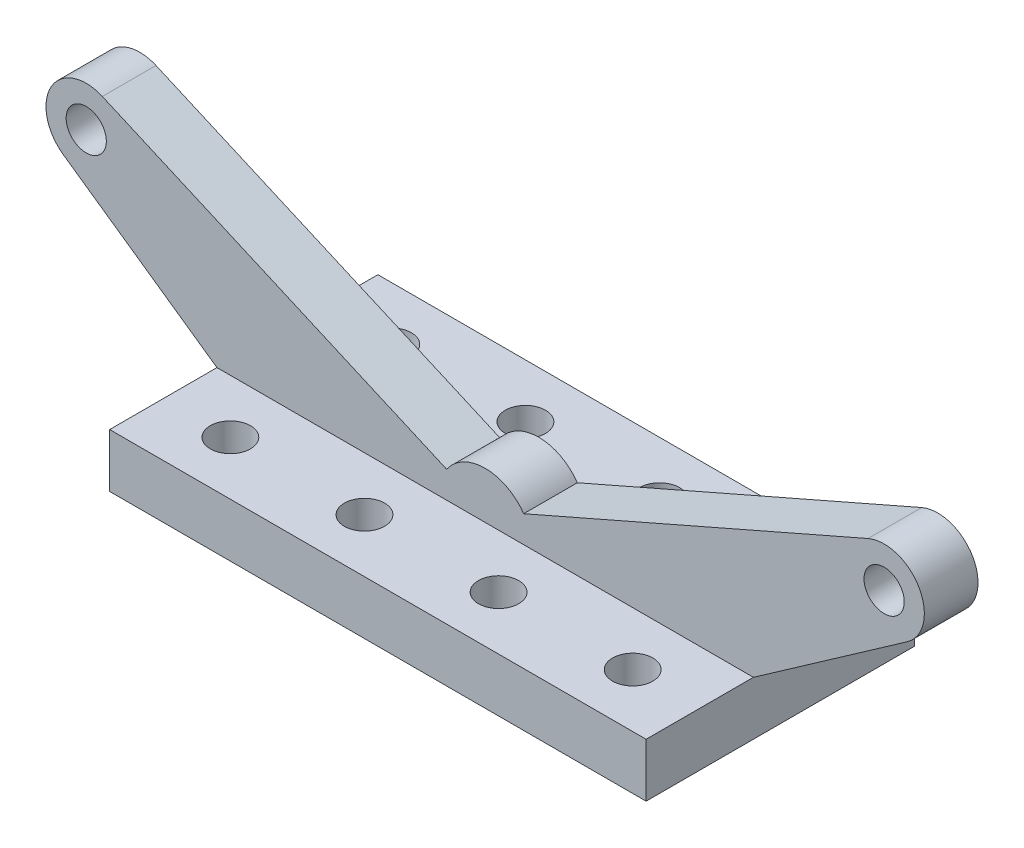
from build123d import *

# Parameters (mm, degrees)
SKETCH1_W           = 200
SKETCH1_H           = 100
SKETCH1_R           = 7.5
BOSS_EXTRUDE1_DEPTH = 20
SKETCH2_R           = 7.5
BOSS_EXTRUDE2_DEPTH = 10


with BuildPart() as part:
    # Sketch1 → Boss-Extrude1 (new body)
    with BuildSketch(Plane(origin=(0, 0, 0), x_dir=(1, 0, 0), z_dir=(0, 1, 0))):
        Rectangle(SKETCH1_W, SKETCH1_H)
        with Locations(Location((-75, 30, 0), (0, 0, 270))):
            Circle(SKETCH1_R, mode=Mode.SUBTRACT)
        with Locations(Location((-75, -30, 0), (0, 0, 270))):
            Circle(SKETCH1_R, mode=Mode.SUBTRACT)
        with Locations(Location((-25, 30, 0), (0, 0, 270))):
            Circle(SKETCH1_R, mode=Mode.SUBTRACT)
        with Locations(Location((-25, -30, 0), (0, 0, 270))):
            Circle(SKETCH1_R, mode=Mode.SUBTRACT)
        with Locations(Location((25, 30, 0), (0, 0, 270))):
            Circle(SKETCH1_R, mode=Mode.SUBTRACT)
        with Locations(Location((25, -30, 0), (0, 0, 270))):
            Circle(SKETCH1_R, mode=Mode.SUBTRACT)
        with Locations(Location((75, 30, 0), (0, 0, 270))):
            Circle(SKETCH1_R, mode=Mode.SUBTRACT)
        with Locations(Location((75, -30, 0), (0, 0, 270))):
            Circle(SKETCH1_R, mode=Mode.SUBTRACT)
    extrude(amount=BOSS_EXTRUDE1_DEPTH)

    # Sketch2 → Boss-Extrude2 (add, symmetric)
    with BuildSketch(Plane.XY):
        with BuildLine():
            Line((-100, 20), (-157.3406431, 60.150350545))
            ThreePointArc((-157.3406431, 60.150350545), (-161.81564798, 79.782621127), (-142.722823192, 86.17916383))
            Line((-142.722823192, 86.17916383), (-14.361406616, 30))
            ThreePointArc((-14.361406616, 30), (0, 37.5), (14.361406616, 30))
            Line((14.361406616, 30), (142.722823192, 86.17916383))
            ThreePointArc((142.722823192, 86.17916383), (161.81564798, 79.782621127), (157.3406431, 60.150350545))
            Line((157.3406431, 60.150350545), (100, 20))
            Line((100, 20), (-100, 20))
        make_face()
        with Locations((-148.736996555, 72.437631209)):
            Circle(SKETCH2_R, mode=Mode.SUBTRACT)
        with Locations(Location((148.736996555, 72.437631209, 0), (0, 0, 180))):
            Circle(SKETCH2_R, mode=Mode.SUBTRACT)
    extrude(amount=BOSS_EXTRUDE2_DEPTH, both=True)


solid = part.part
